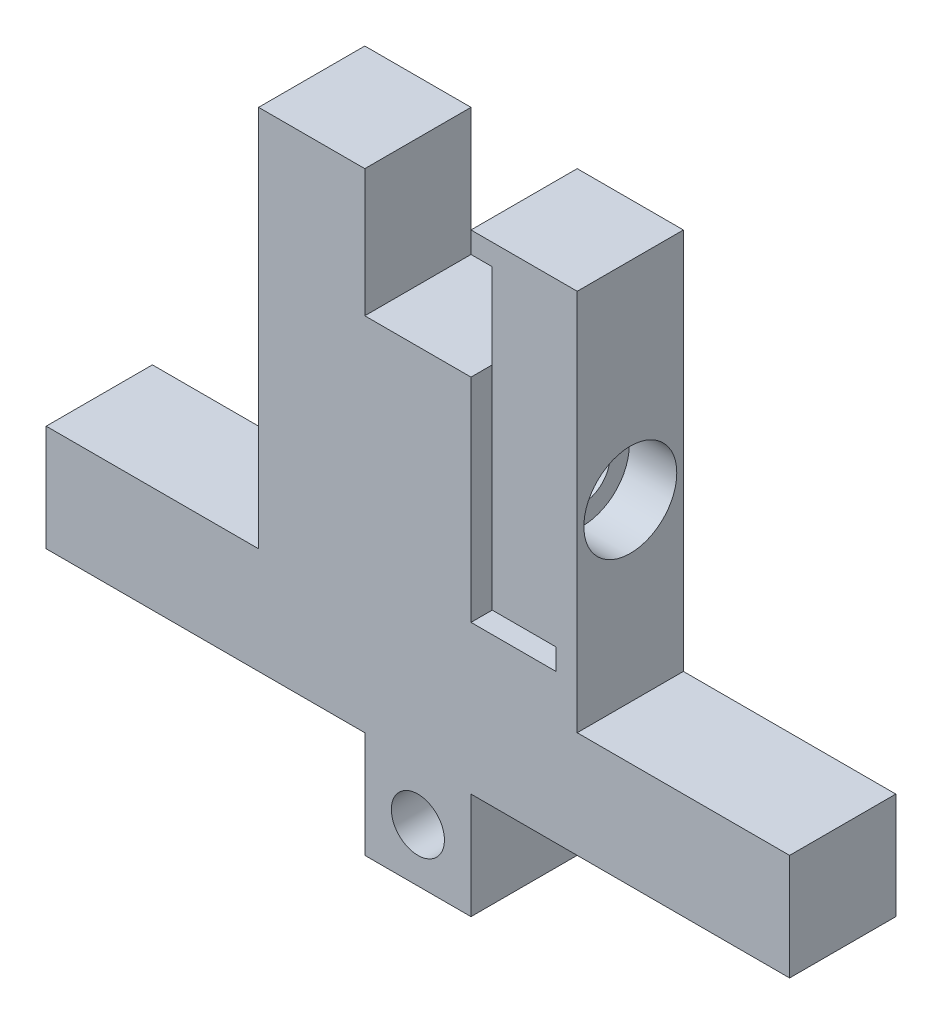
from build123d import *

# Parameters (mm, degrees)
SKETCH2_W                                      = 19.05
SKETCH2_H                                      = 31.75
BOSS_EXTRUDE1_DEPTH                            = 3.175
CUT_EXTRUDE1_DEPTH                             = 23.857707289
SKETCH6_W                                      = 1.27
SKETCH6_H                                      = 17.78
SKETCH6_H_2                                    = 1.27
SKETCH6_W_2                                    = 3.81
CUT_EXTRUDE2_DEPTH                             = 23.857707289
CBORE_FOR_4_SOCKET_HEAD_CAP_SCREW1_D           = 3.2639
CBORE_FOR_4_SOCKET_HEAD_CAP_SCREW1_DEPTH       = 5.08
CBORE_FOR_4_SOCKET_HEAD_CAP_SCREW1_CBORE_D     = 5.55752
CBORE_FOR_4_SOCKET_HEAD_CAP_SCREW1_CBORE_DEPTH = 2.8448
F_4_40_TAPPED_HOLE1_D                          = 2.2606
SKETCH20_W                                     = 12.7
SKETCH20_H                                     = 6.35
BOSS_EXTRUDE2_DEPTH                            = 6.35
SKETCH21_W                                     = 6.35
SKETCH21_H                                     = 12.7
BOSS_EXTRUDE4_DEPTH                            = 6.35
SKETCH22_R                                     = 1.5875
CUT_EXTRUDE3_DEPTH                             = 33.065928179


with BuildPart() as part:
    # Sketch2 → Boss-Extrude1 (new, symmetric)
    with BuildSketch(Plane.XY):
        Rectangle(SKETCH2_W, SKETCH2_H)
    extrude(amount=BOSS_EXTRUDE1_DEPTH, both=True)

    # Sketch4 → Cut-Extrude1 (cut, through all)
    with BuildSketch(Plane(origin=(-1.506852909, 3.110534069, 3.175), x_dir=(1, 0, 0), z_dir=(0, 0, 1))):
        Polygon((-8.018147091, 12.764465931), (-8.018147091, 10.224465931), (-1.668147091, 10.224465931), (-1.668147091, 2.604465931), (4.681852909, 2.604465931), (4.681852909, 10.224465931), (11.031852909, 10.224465931), (11.031852909, 12.764465931), align=None)
    extrude(amount=-CUT_EXTRUDE1_DEPTH, mode=Mode.SUBTRACT)

    # Sketch6 → Cut-Extrude2 (cut, through all)
    with BuildSketch(Plane(origin=(-1.506852909, 3.110534069, 3.175), x_dir=(1, 0, 0), z_dir=(0, 0, 1))):
        with Locations((5.316852909, 0.064465931)):
            Rectangle(SKETCH6_W, SKETCH6_H)
        with Locations((5.316852909, -9.460534069)):
            Rectangle(SKETCH6_W, SKETCH6_H_2)
        with Locations((7.856852909, -9.460534069)):
            Rectangle(SKETCH6_W_2, SKETCH6_H_2)
    extrude(amount=-CUT_EXTRUDE2_DEPTH, mode=Mode.SUBTRACT)

    # CBORE for #4 Socket Head Cap Screw1
    with Locations(Plane(origin=(9.525, 0, 0), x_dir=(0, 0, -1), z_dir=(1, 0, 0))):
        with Locations((0, 0.9525)):
            CounterBoreHole(CBORE_FOR_4_SOCKET_HEAD_CAP_SCREW1_D / 2, CBORE_FOR_4_SOCKET_HEAD_CAP_SCREW1_CBORE_D / 2, CBORE_FOR_4_SOCKET_HEAD_CAP_SCREW1_CBORE_DEPTH, depth=CBORE_FOR_4_SOCKET_HEAD_CAP_SCREW1_DEPTH)

    # #4-40 Tapped Hole1 (through all)
    with Locations(Plane(origin=(3.175, 0, 0), x_dir=(0, 0, -1), z_dir=(1, 0, 0))):
        with Locations((0, 0.9525)):
            Hole(F_4_40_TAPPED_HOLE1_D / 2)

    # Sketch20 → Boss-Extrude2 (add, through all)
    with BuildSketch(Plane.XY.offset(3.175)):
        with Locations((15.875, -12.7)):
            Rectangle(SKETCH20_W, SKETCH20_H)
    boss_extrude2 = extrude(amount=-BOSS_EXTRUDE2_DEPTH)

    # Mirror1: Boss-Extrude2 across plane
    add(boss_extrude2.mirror(Plane(origin=(0, 0, 0), x_dir=(0, 0, 1), z_dir=(1, 0, 0))))

    # Sketch21 → Boss-Extrude4 (add, through all)
    with BuildSketch(Plane(origin=(0, 0, -3.175), x_dir=(-1, 0, 0), z_dir=(0, 0, -1))):
        with Locations((0, -15.875)):
            Rectangle(SKETCH21_W, SKETCH21_H)
    extrude(amount=-BOSS_EXTRUDE4_DEPTH)

    # Sketch22 → Cut-Extrude3 (cut, through all)
    with BuildSketch(Plane(origin=(0, 0, -3.175), x_dir=(-1, 0, 0), z_dir=(0, 0, -1))):
        with Locations((0, -19.05)):
            Circle(SKETCH22_R)
    extrude(amount=-CUT_EXTRUDE3_DEPTH, mode=Mode.SUBTRACT)


solid = part.part
